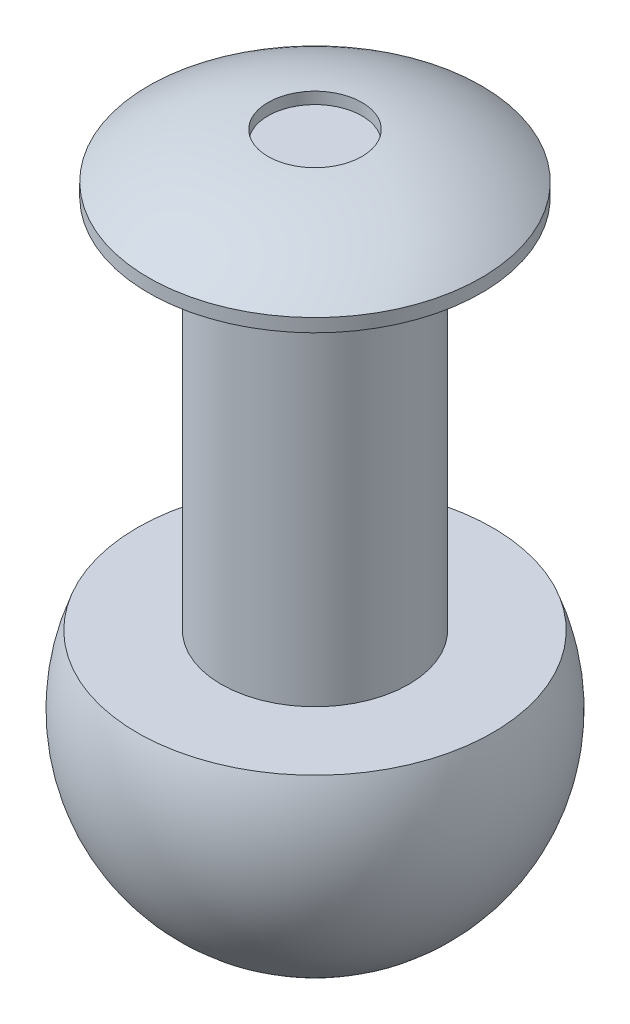
from build123d import *

# Parameters (mm, degrees)
SKETCH1_R           = 2
BOSS_EXTRUDE1_DEPTH = 8
CUT_EXTRUDE1_START  = 11
SKETCH4_R           = 1
CUT_EXTRUDE1_DEPTH  = 2


with BuildPart() as part:
    # Sketch1 → Boss-Extrude1 (new body)
    with BuildSketch(Plane(origin=(0, 0, 0), x_dir=(1, 0, 0), z_dir=(0, 1, 0))):
        with Locations(Location((0, 0, 0), (0, 0, 270))):
            Circle(SKETCH1_R)
    extrude(amount=BOSS_EXTRUDE1_DEPTH)

    # Sketch2 → Revolve1 (revolve)
    with BuildSketch(Plane.XY):
        with BuildLine():
            Line((0, 0), (-3.78822299, 0))
            ThreePointArc((-3.78822299, 0), (-3.344172104, -3.752614622), (0, -5.512106206))
            Line((0, -5.512106206), (0, 0))
        make_face()
    revolve(axis=Axis((0, 0, 0), (0, -1, 0)))

    # Sketch3 → Revolve2 (revolve)
    with BuildSketch(Plane.XY):
        with BuildLine():
            ThreePointArc((-3.547394753, 8.281571529), (-1.865198603, 9.097729481), (0, 9.227851973))
            Line((0, 9.227851973), (0, 8))
            Line((0, 8), (-3.547394753, 8))
            Line((-3.547394753, 8), (-3.547394753, 8.281571529))
        make_face()
    revolve(axis=Axis((0, 8, 0), (0, 1, 0)))

    # Sketch4 → Cut-Extrude1 (cut)
    with BuildSketch(Plane(origin=(0, 0, 0), x_dir=(1, 0, 0), z_dir=(0, 1, 0)).offset(CUT_EXTRUDE1_START)):
        with Locations(Location((0, 0, 0), (0, 0, 270))):
            Circle(SKETCH4_R)
    extrude(amount=-CUT_EXTRUDE1_DEPTH, mode=Mode.SUBTRACT)


solid = part.part
